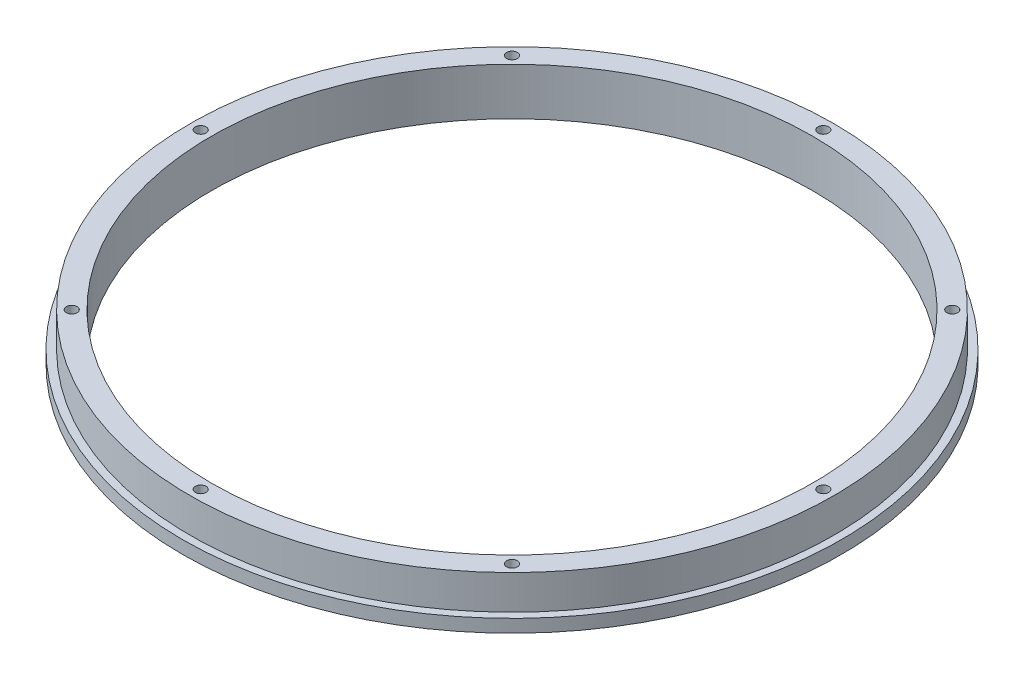
from build123d import *

# Parameters (mm, degrees)
HOLE_WIZARD_M3_1_D = 2.5


with BuildPart() as part:
    # 草图1 → 旋转1 (revolve)
    with BuildSketch(Plane.XY, mode=Mode.PRIVATE) as revolve_1_sk:
        Polygon((70, 0), (76.75, 0), (76.75, 3), (75, 3), (75, 11), (70, 11), align=None)
    revolve(revolve_1_sk.sketch.rotate(Axis((0, 51.694672702, 0), (0, -1, 0)), 90), axis=Axis((0, 51.694672702, 0), (0, -1, 0)))

    # M3 螺纹孔1 (through all)
    with Locations(Plane(origin=(0, 11, 0), x_dir=(1, 0, 0), z_dir=(0, 1, 0))):
        with Locations((-51.265241636, 51.265241636), (0, 72.5), (51.265241636, 51.265241636), (72.5, 0), (51.265241636, -51.265241636), (0, -72.5), (-51.265241636, -51.265241636), (-72.5, 0)):
            Hole(HOLE_WIZARD_M3_1_D / 2)


solid = part.part
